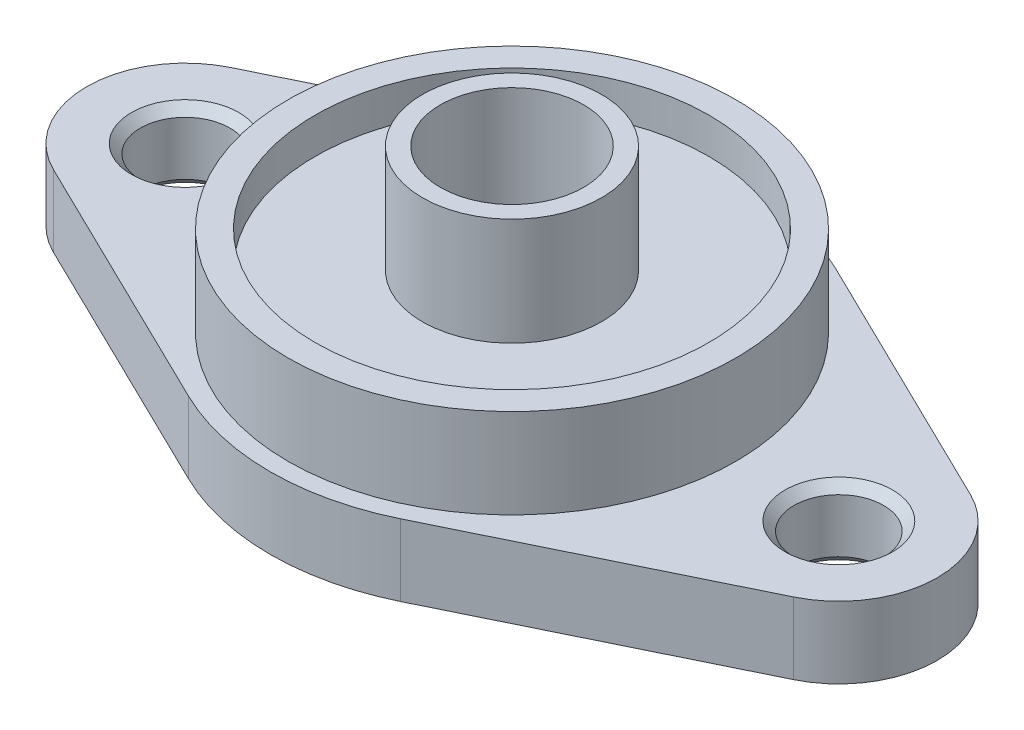
from build123d import *

# Parameters (mm, degrees)
CROQUIS1_R              = 4
CROQUIS1_R_2            = 2.5
SALIENTE_EXTRUIR1_DEPTH = 4
CROQUIS2_R              = 5
CROQUIS2_R_2            = 4
SALIENTE_EXTRUIR2_DEPTH = 9
CROQUIS3_R              = 12.5
CROQUIS3_R_2            = 11
SALIENTE_EXTRUIR3_DEPTH = 5
CROQUIS5_R              = 11
CROQUIS5_R_2            = 5
SALIENTE_EXTRUIR4_DEPTH = 3
CHAFL_N1_SIZE           = 0.5


with BuildPart() as part:
    # Croquis1 → Saliente-Extruir1 (new body)
    with BuildSketch(Plane(origin=(0, 0, 0), x_dir=(1, 0, 0), z_dir=(0, 1, 0))):
        with BuildLine():
            Line((-5.917808219, 12.133818273), (-20.660958904, 4.943407445))
            ThreePointArc((-20.660958904, 4.943407445), (-23.75, 0), (-20.660958904, -4.943407445))
            Line((-20.660958904, -4.943407445), (-5.917808219, -12.133818273))
            ThreePointArc((-5.917808219, -12.133818273), (0, -13.5), (5.917808219, -12.133818273))
            Line((5.917808219, -12.133818273), (20.660958904, -4.943407445))
            ThreePointArc((20.660958904, -4.943407445), (23.75, 0), (20.660958904, 4.943407445))
            Line((20.660958904, 4.943407445), (5.917808219, 12.133818273))
            ThreePointArc((5.917808219, 12.133818273), (0, 13.5), (-5.917808219, 12.133818273))
        make_face()
        with Locations(Location((0, 0, 0), (0, 0, 270))):
            Circle(CROQUIS1_R, mode=Mode.SUBTRACT)
        with Locations(Location((-18.25, 0, 0), (0, 0, 270))):
            Circle(CROQUIS1_R_2, mode=Mode.SUBTRACT)
        with Locations(Location((18.25, 0, 0), (0, 0, 270))):
            Circle(CROQUIS1_R_2, mode=Mode.SUBTRACT)
    extrude(amount=SALIENTE_EXTRUIR1_DEPTH)

    # Croquis2 → Saliente-Extruir2 (add)
    with BuildSketch(Plane(origin=(0, 4, 0), x_dir=(1, 0, 0), z_dir=(0, 1, 0))):
        with Locations(Location((0, 0, 0), (0, 0, 270))):
            Circle(CROQUIS2_R)
        with Locations(Location((0, 0, 0), (0, 0, 270))):
            Circle(CROQUIS2_R_2, mode=Mode.SUBTRACT)
    extrude(amount=SALIENTE_EXTRUIR2_DEPTH)

    # Croquis3 → Saliente-Extruir3 (add)
    with BuildSketch(Plane(origin=(0, 4, 0), x_dir=(1, 0, 0), z_dir=(0, 1, 0))):
        with Locations(Location((0, 0, 0), (0, 0, 270))):
            Circle(CROQUIS3_R)
        with Locations(Location((0, 0, 0), (0, 0, 270))):
            Circle(CROQUIS3_R_2, mode=Mode.SUBTRACT)
    extrude(amount=SALIENTE_EXTRUIR3_DEPTH)

    # Croquis5 → Saliente-Extruir4 (add)
    with BuildSketch(Plane(origin=(0, 4, 0), x_dir=(1, 0, 0), z_dir=(0, 1, 0))):
        with Locations(Location((0, 0, 0), (0, 0, 270))):
            Circle(CROQUIS5_R)
        with Locations(Location((0, 0, 0), (0, 0, 270))):
            Circle(CROQUIS5_R_2, mode=Mode.SUBTRACT)
    extrude(amount=SALIENTE_EXTRUIR4_DEPTH)

    # Chaflán1
    chafl_n1_edges = [part.edges().sort_by_distance(p)[0] for p in [
        (-18.25, 0, -2.5),
        (-18.25, 4, -2.5),
        (18.25, 0, -2.5),
        (18.25, 4, -2.5),
    ]]
    chamfer(chafl_n1_edges, length=CHAFL_N1_SIZE)


solid = part.part
